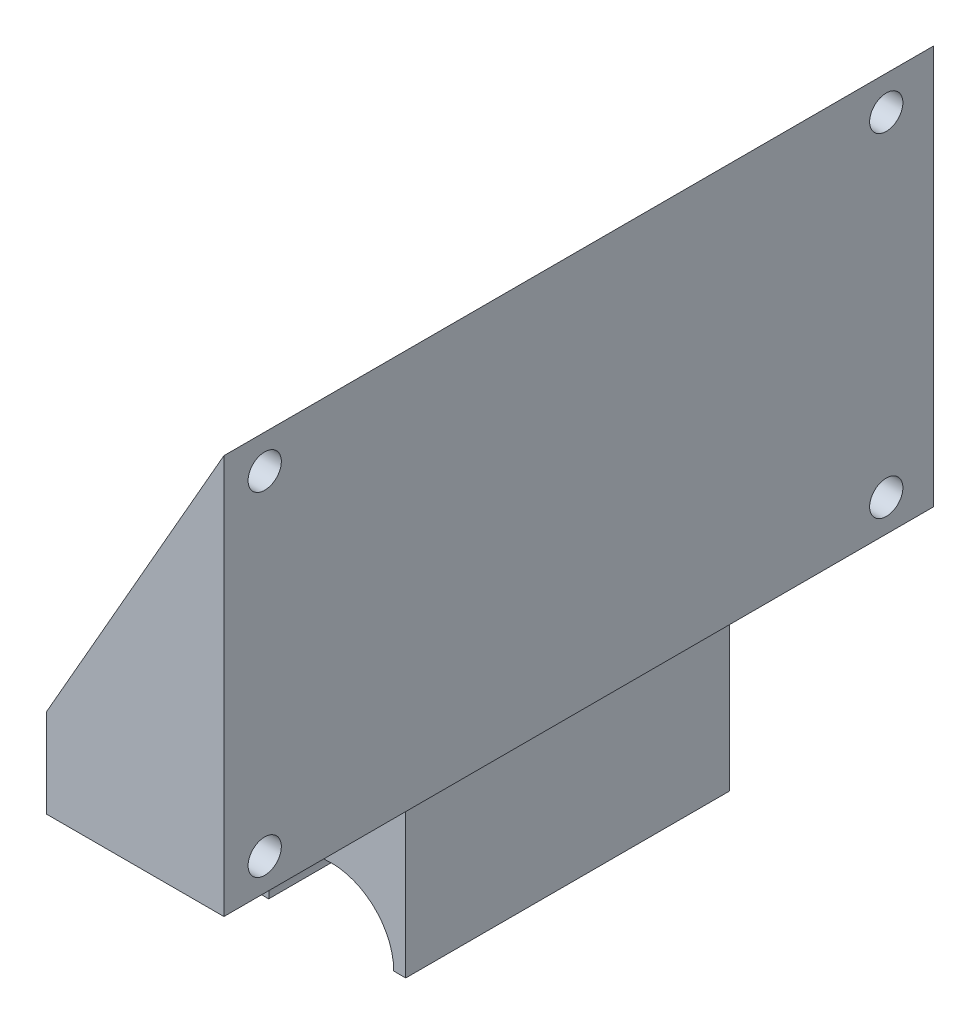
from build123d import *

# Parameters (mm, degrees)
BOSS_EXTRUDE1_DEPTH     = 101.6
SKETCH4_W               = 21.336
SKETCH4_H               = 46.355
BOSS_EXTRUDE2_DEPTH     = 22.225
CUT_EXTRUDE5_DEPTH      = 97.870805748
CUT_EXTRUDE5_DEPTH_BACK = 97.870805748
SKETCH8_R               = 2.38125
CUT_EXTRUDE6_DEPTH      = 120.305668348


with BuildPart() as part:
    # Sketch1 → Boss-Extrude1 (new body)
    with BuildSketch(Plane.XY):
        Polygon((0, 0), (25.4, 0), (25.4, 57.15), (0, 12.7), align=None)
    extrude(amount=-BOSS_EXTRUDE1_DEPTH)

    # Sketch4 → Boss-Extrude2 (add)
    with BuildSketch(Plane(origin=(21.809590146, 0, -29.461184826), x_dir=(-1, 0, 0), z_dir=(0, -1, 0))):
        with Locations((8.665090146, 21.338815174)):
            Rectangle(SKETCH4_W, SKETCH4_H)
    extrude(amount=BOSS_EXTRUDE2_DEPTH)

    # Sketch7 → Cut-Extrude5 (cut, two sides: drawn at the far end of the back side and taken through both)
    with BuildSketch(Plane(origin=(0, 0, -73.9775), x_dir=(-1, 0, 0), z_dir=(0, 0, -1)).offset(-CUT_EXTRUDE5_DEPTH_BACK)):
        with BuildLine():
            Line((-22.098, -197.012283842), (-22.098, -22.225))
            ThreePointArc((-22.098, -22.225), (-13.1445, -13.2715), (-4.191, -22.225))
            Line((-4.191, -22.225), (-4.191, -197.012283842))
            Line((-4.191, -197.012283842), (-4.191, -546.586851526))
            Line((-4.191, -546.586851526), (-22.098, -546.586851526))
            Line((-22.098, -546.586851526), (-22.098, -197.012283842))
        make_face()
    extrude(amount=CUT_EXTRUDE5_DEPTH + CUT_EXTRUDE5_DEPTH_BACK, mode=Mode.SUBTRACT)

    # Sketch8 → Cut-Extrude6 (cut, through all)
    with BuildSketch(Plane(origin=(25.4, 0, 0), x_dir=(0, 0, -1), z_dir=(1, 0, 0))):
        with Locations(Location((5.842, 52.324, 0), (0, 0, 90))):
            Circle(SKETCH8_R)
        with Locations(Location((5.842, 4.572, 0), (0, 0, 90))):
            Circle(SKETCH8_R)
        with Locations(Location((94.837878374, 4.572, 0), (0, 0, 90))):
            Circle(SKETCH8_R)
        with Locations(Location((94.837878374, 52.324, 0), (0, 0, 90))):
            Circle(SKETCH8_R)
    extrude(amount=-CUT_EXTRUDE6_DEPTH, mode=Mode.SUBTRACT)


solid = part.part
